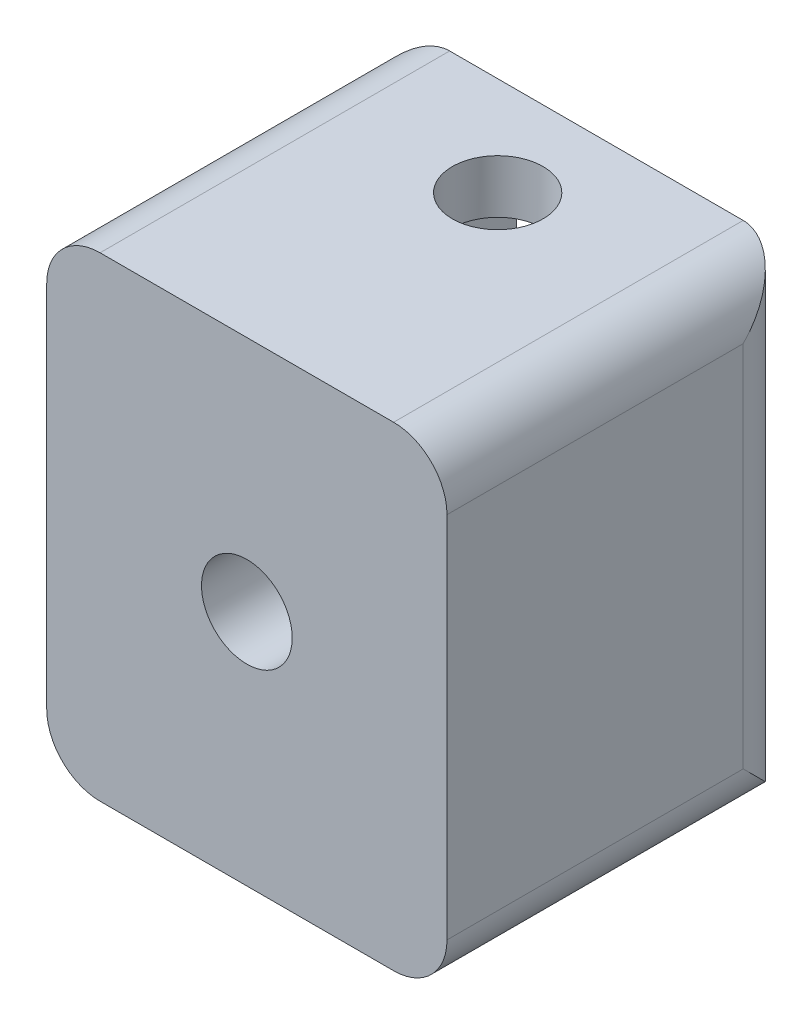
from build123d import *

# Parameters (mm, degrees)
SKETCH_1_W               = 15
SKETCH_1_H               = 17.8
SKETCH_1_R               = 3
SKETCH_1_W_2             = 6
SKETCH_1_H_2             = 2.9
SKETCH_1_R_2             = 1.7
EXTRUDE_1_DEPTH          = 3.2
SKETCH_1_3_W             = 15
SKETCH_1_3_H             = 17.8
SKETCH_1_3_R             = 3
SKETCH_1_3_W_2           = 6
SKETCH_1_3_H_2           = 2.9
EXTRUDE_2_DEPTH          = 2.2
EXTRUDE_START            = -2.2
SKETCH_1_4_W             = 15
SKETCH_1_4_H             = 17.8
SKETCH_1_4_R             = 3
SKETCH_1_4_W_2           = 6
SKETCH_1_4_H_2           = 2.9
EXTRUDE_3_DEPTH          = 7.7
CUT_EXTRUDE_1_DEPTH      = 16.279725128
CUT_EXTRUDE_1_DEPTH_BACK = 16.279725128
SKETCH_2_R               = 1.7
FILLET_1_R               = 2


with BuildPart() as part:
    # 草图1 → 凸台-拉伸1 (new body)
    # profile 1 of 4: a face of its own
    with BuildSketch(Plane.XY):
        Rectangle(SKETCH_1_W, SKETCH_1_H)
        Circle(SKETCH_1_R, mode=Mode.SUBTRACT)
        with Locations((0, -5.45)):
            Rectangle(SKETCH_1_W_2, SKETCH_1_H_2, mode=Mode.SUBTRACT)
        with Locations((0, 5.45)):
            Rectangle(SKETCH_1_W_2, SKETCH_1_H_2, mode=Mode.SUBTRACT)
    # profile 2 of 4: a face of its own
    with BuildSketch(Plane.XY):
        Circle(SKETCH_1_R)
        Circle(SKETCH_1_R_2, mode=Mode.SUBTRACT)
    # profile 3 of 4: a face of its own
    with BuildSketch(Plane.XY):
        with Locations((0, 5.45)):
            Rectangle(SKETCH_1_W_2, SKETCH_1_H_2)
    # profile 4 of 4: a face of its own
    with BuildSketch(Plane.XY):
        with Locations((0, -5.45)):
            Rectangle(SKETCH_1_W_2, SKETCH_1_H_2)
    extrude(amount=EXTRUDE_1_DEPTH)

    # 草图1<3> → 凸台-拉伸2 (add)
    # profile 1 of 3: a face of its own
    with BuildSketch(Plane.XY):
        Rectangle(SKETCH_1_3_W, SKETCH_1_3_H)
        Circle(SKETCH_1_3_R, mode=Mode.SUBTRACT)
        with Locations((0, -5.45)):
            Rectangle(SKETCH_1_3_W_2, SKETCH_1_3_H_2, mode=Mode.SUBTRACT)
        with Locations((0, 5.45)):
            Rectangle(SKETCH_1_3_W_2, SKETCH_1_3_H_2, mode=Mode.SUBTRACT)
    # profile 2 of 3: a face of its own
    with BuildSketch(Plane.XY):
        with Locations((0, 5.45)):
            Rectangle(SKETCH_1_3_W_2, SKETCH_1_3_H_2)
    # profile 3 of 3: a face of its own
    with BuildSketch(Plane.XY):
        with Locations((0, -5.45)):
            Rectangle(SKETCH_1_3_W_2, SKETCH_1_3_H_2)
    extrude(amount=-EXTRUDE_2_DEPTH)

    # 草图1<4> → 凸台-拉伸3 (add)
    with BuildSketch(Plane.XY.offset(EXTRUDE_START)):
        Rectangle(SKETCH_1_4_W, SKETCH_1_4_H)
        Circle(SKETCH_1_4_R, mode=Mode.SUBTRACT)
        with Locations((0, -5.45)):
            Rectangle(SKETCH_1_4_W_2, SKETCH_1_4_H_2, mode=Mode.SUBTRACT)
        with Locations((0, 5.45)):
            Rectangle(SKETCH_1_4_W_2, SKETCH_1_4_H_2, mode=Mode.SUBTRACT)
    extrude(amount=-EXTRUDE_3_DEPTH)

    # 草图2 → 切除-拉伸1 (cut, two sides: drawn at the far end of the back side and taken through both)
    with BuildSketch(Plane(origin=(0, 0, 0), x_dir=(1, 0, 0), z_dir=(0, 1, 0)).offset(-CUT_EXTRUDE_1_DEPTH_BACK)):
        with Locations(Location((0, 6.2, 0), (0, 0, 270))):
            Circle(SKETCH_2_R)
    extrude(amount=CUT_EXTRUDE_1_DEPTH + CUT_EXTRUDE_1_DEPTH_BACK, mode=Mode.SUBTRACT)

    # 圆角1
    fillet_1_edges = [part.edges().sort_by_distance(p)[0] for p in [
        (-7.5, -8.9, -3.35),
        (-7.5, 8.9, -3.35),
        (7.5, 8.9, -3.35),
        (7.5, -8.9, -3.35),
        (-7.5, 0, -9.9),
        (7.5, 0, -9.9),
    ]]
    fillet(fillet_1_edges, radius=FILLET_1_R)


solid = part.part
